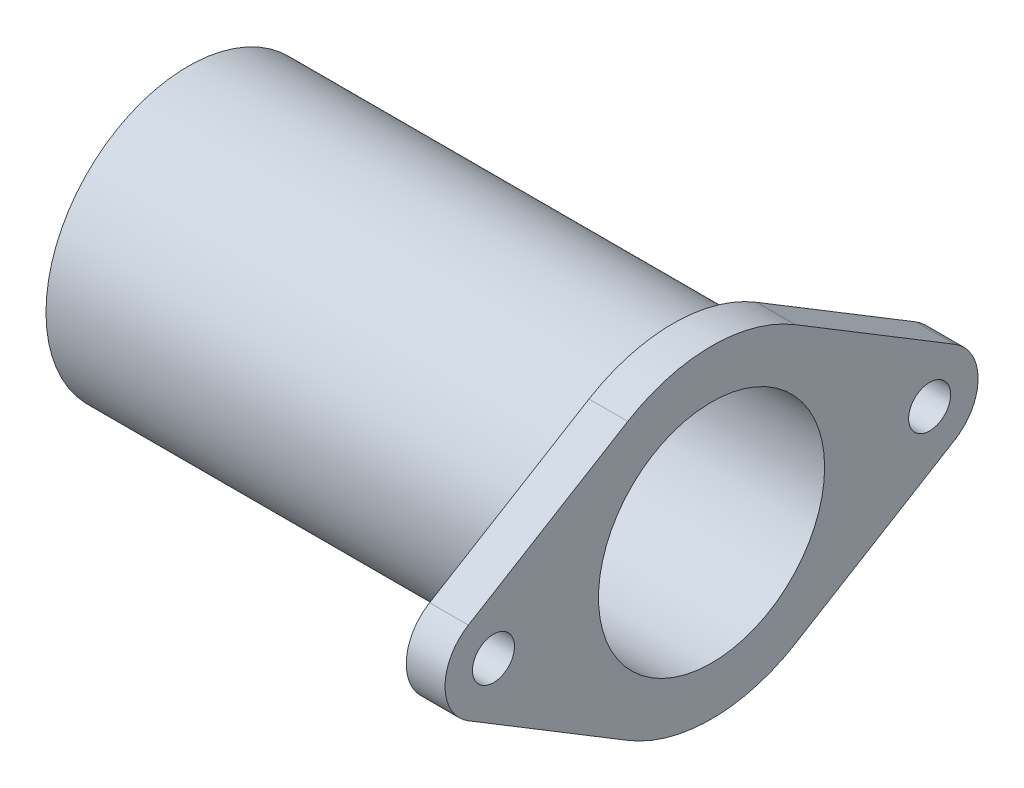
from build123d import *

# Parameters (mm, degrees)
SKETCH1_R           = 44
BOSS_EXTRUDE1_DEPTH = 150
BOSS_EXTRUDE2_DEPTH = 12
SKETCH5_R           = 6.5
CUT_EXTRUDE3_DEPTH  = 80
SKETCH6_R           = 35
CUT_EXTRUDE4_DEPTH  = 147
SKETCH7_R           = 25.5
CUT_EXTRUDE5_DEPTH  = 67


with BuildPart() as part:
    # Sketch1 → Boss-Extrude1 (new body)
    with BuildSketch(Plane(origin=(0, 0, 0), x_dir=(0, 0, -1), z_dir=(1, 0, 0))):
        Circle(SKETCH1_R)
    extrude(amount=BOSS_EXTRUDE1_DEPTH)

    # Sketch2 → Boss-Extrude2 (add)
    with BuildSketch(Plane(origin=(150, 0, 0), x_dir=(0, 0, -1), z_dir=(1, 0, 0))):
        with BuildLine():
            Line((-25.925925926, 42.753319928), (-75.277777778, 12.825995978))
            ThreePointArc((-75.277777778, 12.825995978), (-82.5, 0), (-75.277777778, -12.825995978))
            Line((-75.277777778, -12.825995978), (-25.925925926, -42.753319928))
            ThreePointArc((-25.925925926, -42.753319928), (0, -50), (25.925925926, -42.753319928))
            Line((25.925925926, -42.753319928), (75.277777778, -12.825995978))
            ThreePointArc((75.277777778, -12.825995978), (82.5, 0), (75.277777778, 12.825995978))
            Line((75.277777778, 12.825995978), (25.925925926, 42.753319928))
            ThreePointArc((25.925925926, 42.753319928), (0, 50), (-25.925925926, 42.753319928))
        make_face()
    extrude(amount=BOSS_EXTRUDE2_DEPTH)

    # Sketch5 → Cut-Extrude3 (cut)
    with BuildSketch(Plane(origin=(162, 0, 0), x_dir=(0, 0, -1), z_dir=(1, 0, 0))):
        with Locations((67.5, 0)):
            Circle(SKETCH5_R)
        with Locations((-67.5, 0)):
            Circle(SKETCH5_R)
    extrude(amount=-CUT_EXTRUDE3_DEPTH, mode=Mode.SUBTRACT)

    # Sketch6 → Cut-Extrude4 (cut)
    with BuildSketch(Plane(origin=(162, 0, 0), x_dir=(0, 0, -1), z_dir=(1, 0, 0))):
        Circle(SKETCH6_R)
    extrude(amount=-CUT_EXTRUDE4_DEPTH, mode=Mode.SUBTRACT)

    # Sketch7 → Cut-Extrude5 (cut)
    with BuildSketch(Plane.ZY):
        Circle(SKETCH7_R)
    extrude(amount=-CUT_EXTRUDE5_DEPTH, mode=Mode.SUBTRACT)


solid = part.part
